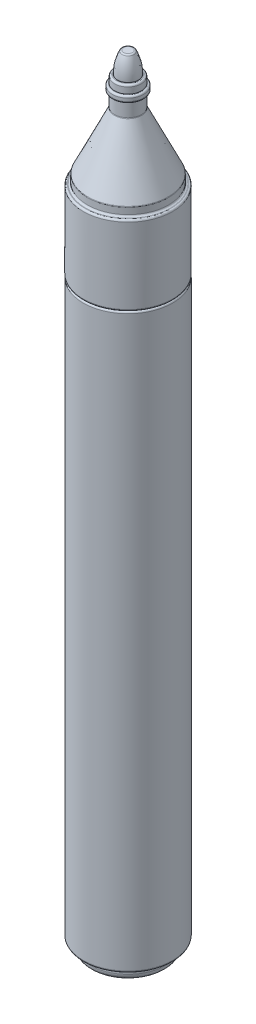
from build123d import *

# Parameters (mm, degrees)
SKETCH1_R           = 7.5
BOSS_EXTRUDE1_DEPTH = 96
FILLET1_R           = 0.3
SKETCH2_R           = 6.349532221
BOSS_EXTRUDE2_DEPTH = 2
FILLET2_R           = 0.3
FILLET3_R           = 0.3
FILLET4_R           = 1


with BuildPart() as part:
    # Sketch1 → Boss-Extrude1 (new body)
    with BuildSketch(Plane(origin=(0, 0, 0), x_dir=(1, 0, 0), z_dir=(0, 1, 0))):
        with Locations(Location((0, 0, 0), (0, 0, 270))):
            Circle(SKETCH1_R)
    extrude(amount=BOSS_EXTRUDE1_DEPTH)

    # Fillet1
    fillet1_edges = [part.edges().sort_by_distance(p)[0] for p in [
        (0, 0, -7.5),
        (0, 96, -7.5),
    ]]
    fillet(fillet1_edges, radius=FILLET1_R)

    # Sketch2 → Boss-Extrude2 (add)
    with BuildSketch(Plane(origin=(0, 0, 0), x_dir=(-1, 0, 0), z_dir=(0, -1, 0))):
        with Locations(Location((0, 0, 0), (0, 0, 270))):
            Circle(SKETCH2_R)
    extrude(amount=BOSS_EXTRUDE2_DEPTH)

    # Fillet4
    fillet4_edges = [part.edges().sort_by_distance(p)[0] for p in [
        (0, -2, -6.349532221),
    ]]
    fillet(fillet4_edges, radius=FILLET4_R)


with BuildPart() as body_2:
    # Sketch3 → Revolve1 (revolve)
    with BuildSketch(Plane.XY, mode=Mode.PRIVATE) as revolve1_sk:
        with BuildLine():
            Line((0, 96), (0, 128.676956491))
            Line((0, 128.676956491), (0.910204856, 128.676956491))
            add(Edge.make_bspline(
                [(0.910204856, 128.676956491), (1.48976739, 127.651546017), (1.756931904, 126.488456163), (1.711698399, 125.187686929)],
                knots=[0.298630267, 0.298630267, 0.298630267, 0.298630267, 1, 1, 1, 1], degree=3))
            Line((1.711698399, 125.187686929), (1.711698399, 124.527585577))
            Line((1.711698399, 124.527585577), (1.77215292, 124.527585577))
            Line((1.77215292, 124.527585577), (1.77215292, 125.187686929))
            Line((1.77215292, 125.187686929), (2.235242332, 125.187686929))
            Line((2.235242332, 125.187686929), (2.235242332, 123.859216575))
            Line((2.235242332, 123.859216575), (2.637658521, 123.859216575))
            Line((2.637658521, 123.859216575), (2.637658521, 122.754171916))
            Line((2.637658521, 122.754171916), (2.235242332, 122.754171916))
            Line((2.235242332, 122.754171916), (2.235242332, 120.356334932))
            Line((2.235242332, 120.356334932), (6.794391311, 110.715390158))
            Line((6.794391311, 110.715390158), (6.794391311, 109.286737815))
            Line((6.794391311, 109.286737815), (7.5, 109.286737815))
            Line((7.5, 109.286737815), (7.5, 96))
            Line((7.5, 96), (0, 96))
        make_face()
    revolve(revolve1_sk.sketch.rotate(Axis((0, 96, 0), (0, 1, 0)), 90), axis=Axis((0, 96, 0), (0, 1, 0)))

    # Fillet2
    fillet2_edges = [body_2.edges().sort_by_distance(p)[0] for p in [
        (0, 96, 7.5),
    ]]
    fillet(fillet2_edges, radius=FILLET2_R)

    # Fillet3
    fillet3_edges = [body_2.edges().sort_by_distance(p)[0] for p in [
        (0, 128.676956491, 0.910204856),
        (0, 125.187686929, 2.235242332),
        (0, 123.859216575, 2.637658521),
        (0, 122.754171916, 2.637658521),
        (0, 120.356334932, 2.235242332),
        (0, 110.715390158, 6.794391311),
        (0, 109.286737815, 6.794391311),
        (0, 109.286737815, 7.5),
    ]]
    fillet(fillet3_edges, radius=FILLET3_R)


solid = Compound([part.part, body_2.part])
